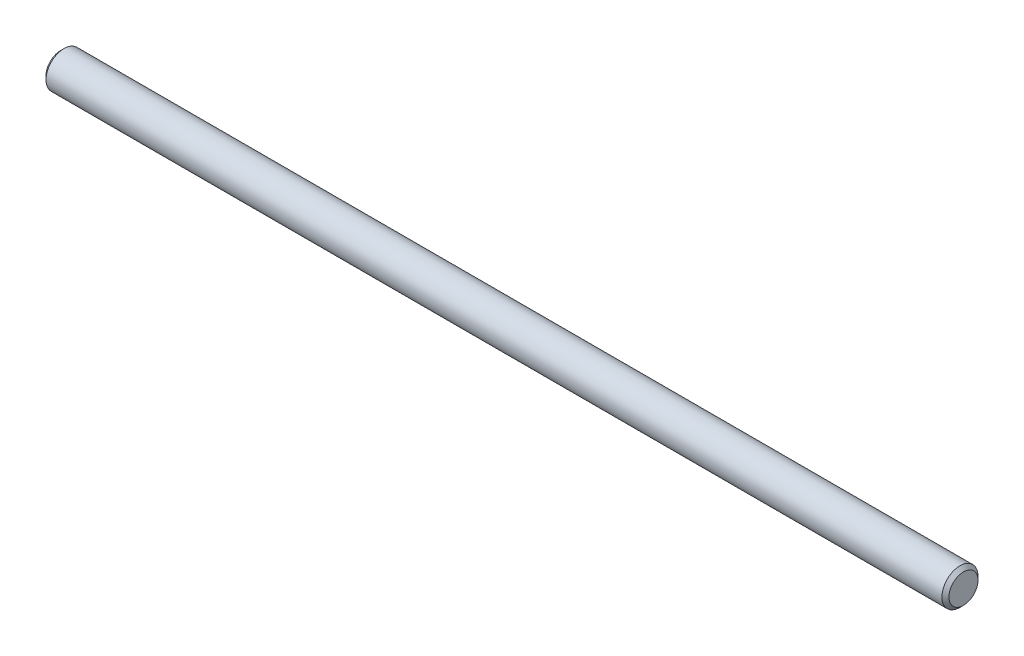
from build123d import *


with BuildPart() as part:
    # Sketch1 → Revolve1 (revolve)
    with BuildSketch(Plane.XY, mode=Mode.PRIVATE) as revolve1_sk:
        Polygon((0, 0), (0, 2.01), (0.49, 2.5), (124.51, 2.5), (125, 2.01), (125, 0), align=None)
    revolve(revolve1_sk.sketch.rotate(Axis((0, 0, 0), (1, 0, 0)), 90), axis=Axis((0, 0, 0), (1, 0, 0)))


solid = part.part
